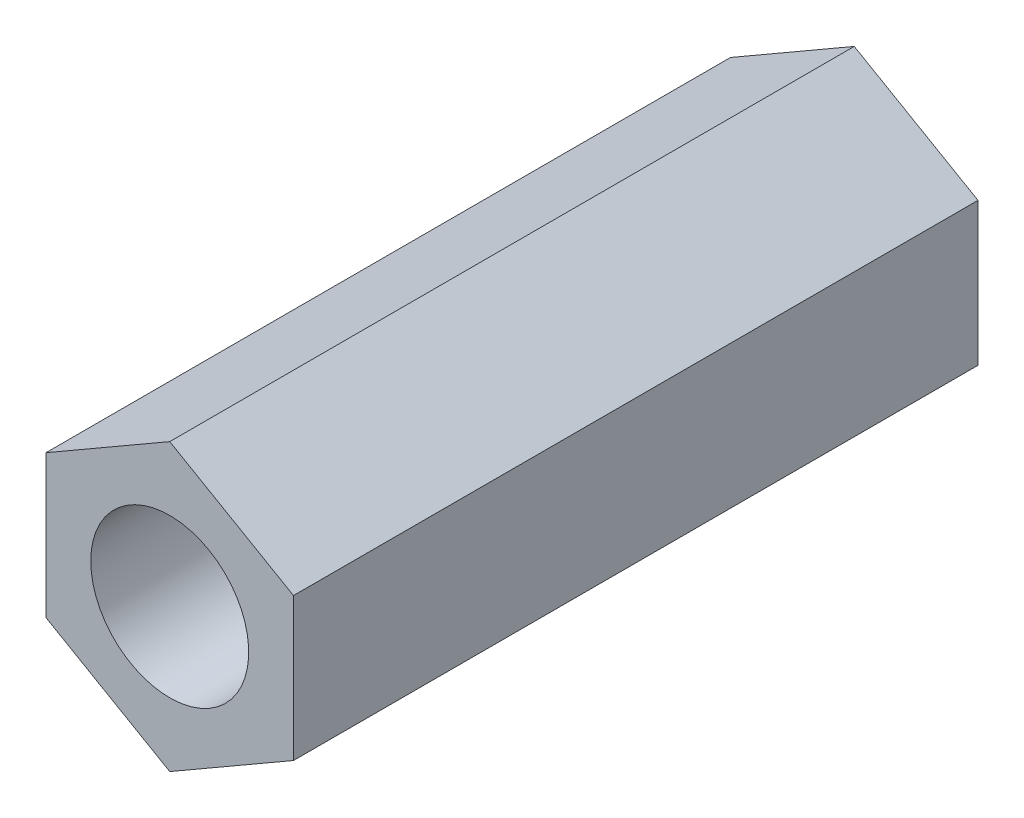
from build123d import *

# Parameters (mm, degrees)
SKETCH_1_R      = 1.5
EXTRUDE_1_DEPTH = 13


with BuildPart() as part:
    # 草图1 → 凸台-拉伸1 (new body)
    with BuildSketch(Plane.XY):
        Polygon((2.35, -1.356773133), (2.35, 1.356773133), (0, 2.713546265), (-2.35, 1.356773133), (-2.35, -1.356773133), (0, -2.713546265), align=None)
        with Locations(Location((0, 0, 0), (0, 0, 180))):
            Circle(SKETCH_1_R, mode=Mode.SUBTRACT)
    extrude(amount=EXTRUDE_1_DEPTH)


solid = part.part
